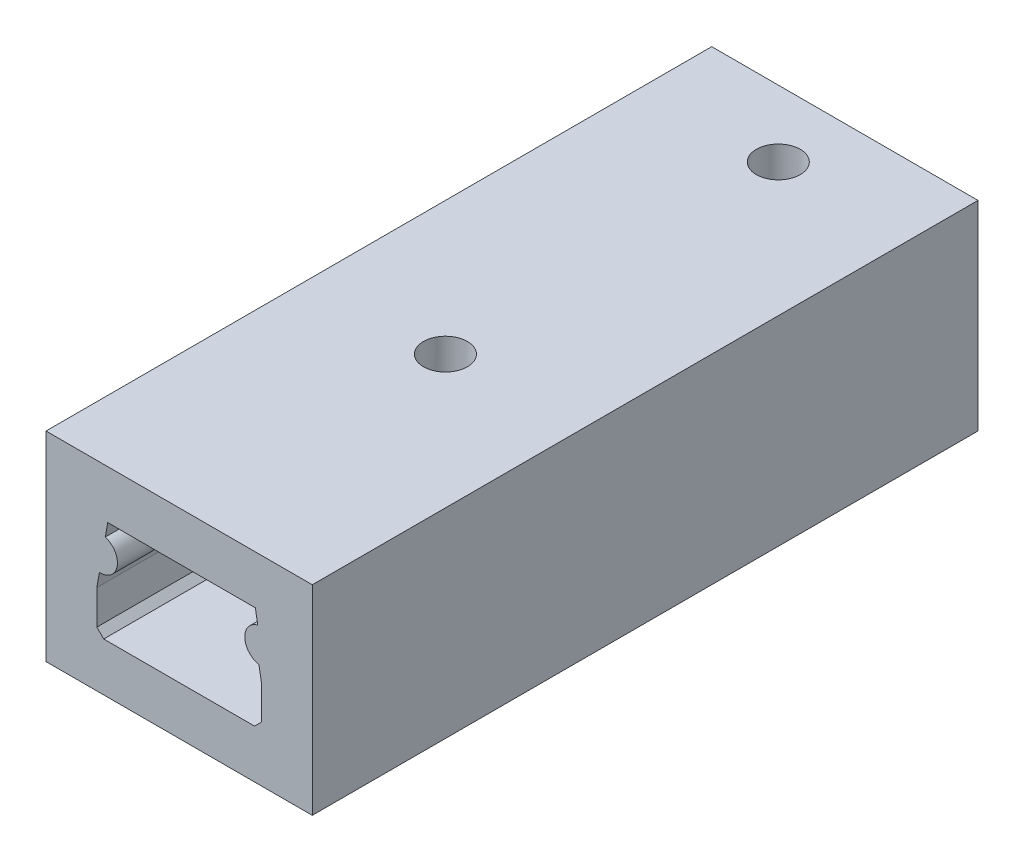
from build123d import *

# Parameters (mm, degrees)
SKETCH2_W           = 20
SKETCH2_H           = 15
BOSS_EXTRUDE1_DEPTH = 50
SKETCH3_R           = 1.65
CUT_EXTRUDE1_DEPTH  = 54.150729064


with BuildPart() as part:
    # Sketch2 → Boss-Extrude1 (new body)
    with BuildSketch(Plane.XY):
        with Locations((0, 3.75)):
            Rectangle(SKETCH2_W, SKETCH2_H)
        with BuildLine():
            Line((6.18, 0.4025), (6.18, 2.9775))
            Line((6.18, 2.9775), (5.988999354, 4.060718492))
            ThreePointArc((5.988999354, 4.060718492), (4.929202717, 5.285218638), (5.905225776, 6.577483513))
            Line((5.905225776, 6.577483513), (5.722724444, 7.6125))
            Line((5.722724444, 7.6125), (-5.362724444, 7.6125))
            Line((-5.362724444, 7.6125), (-5.545225776, 6.577483513))
            ThreePointArc((-5.545225776, 6.577483513), (-4.654560018, 5.122927971), (-5.988999354, 4.060718492))
            Line((-5.988999354, 4.060718492), (-6.18, 2.9775))
            Line((-6.18, 2.9775), (-6.18, 0.4025))
            Line((-6.18, 0.4025), (-5.665, -0.1125))
            Line((-5.665, -0.1125), (5.665, -0.1125))
            Line((5.665, -0.1125), (6.18, 0.4025))
        make_face(mode=Mode.SUBTRACT)
    extrude(amount=BOSS_EXTRUDE1_DEPTH)

    # Sketch3 → Cut-Extrude1 (cut, through all)
    with BuildSketch(Plane(origin=(0, 11.25, 0), x_dir=(1, 0, 0), z_dir=(0, 1, 0))):
        with Locations(Location((0, -5, 0), (0, 0, 270))):
            Circle(SKETCH3_R)
        with Locations(Location((0, -30, 0), (0, 0, 270))):
            Circle(SKETCH3_R)
    extrude(amount=-CUT_EXTRUDE1_DEPTH, mode=Mode.SUBTRACT)


solid = part.part
